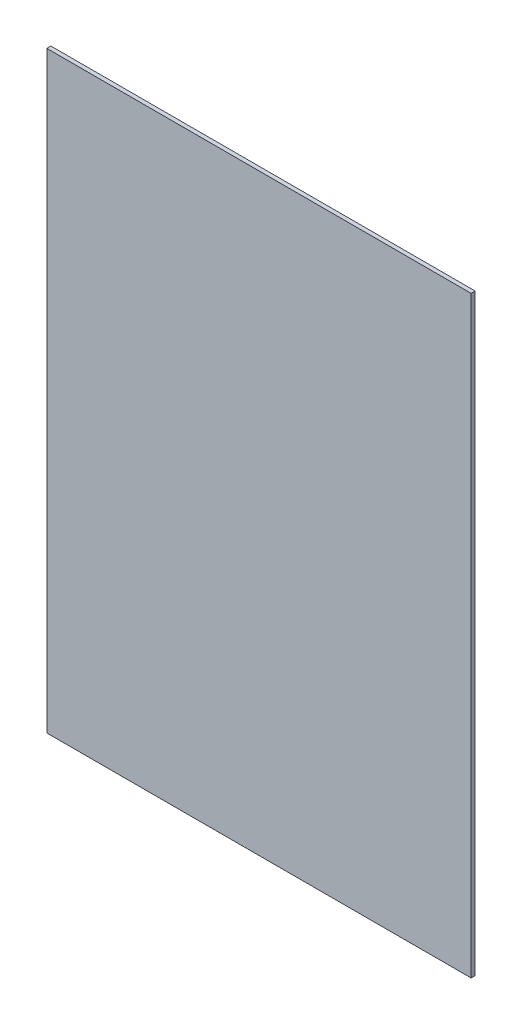
from build123d import *

# Parameters (mm, degrees)
ESQUISSE1_W        = 680
ESQUISSE1_H        = 950
BOSS_EXTRU_1_DEPTH = 6.5


with BuildPart() as part:
    # Esquisse1 → Boss.-Extru.1 (new body)
    with BuildSketch(Plane.XY):
        Rectangle(ESQUISSE1_W, ESQUISSE1_H)
    extrude(amount=BOSS_EXTRU_1_DEPTH)


solid = part.part
